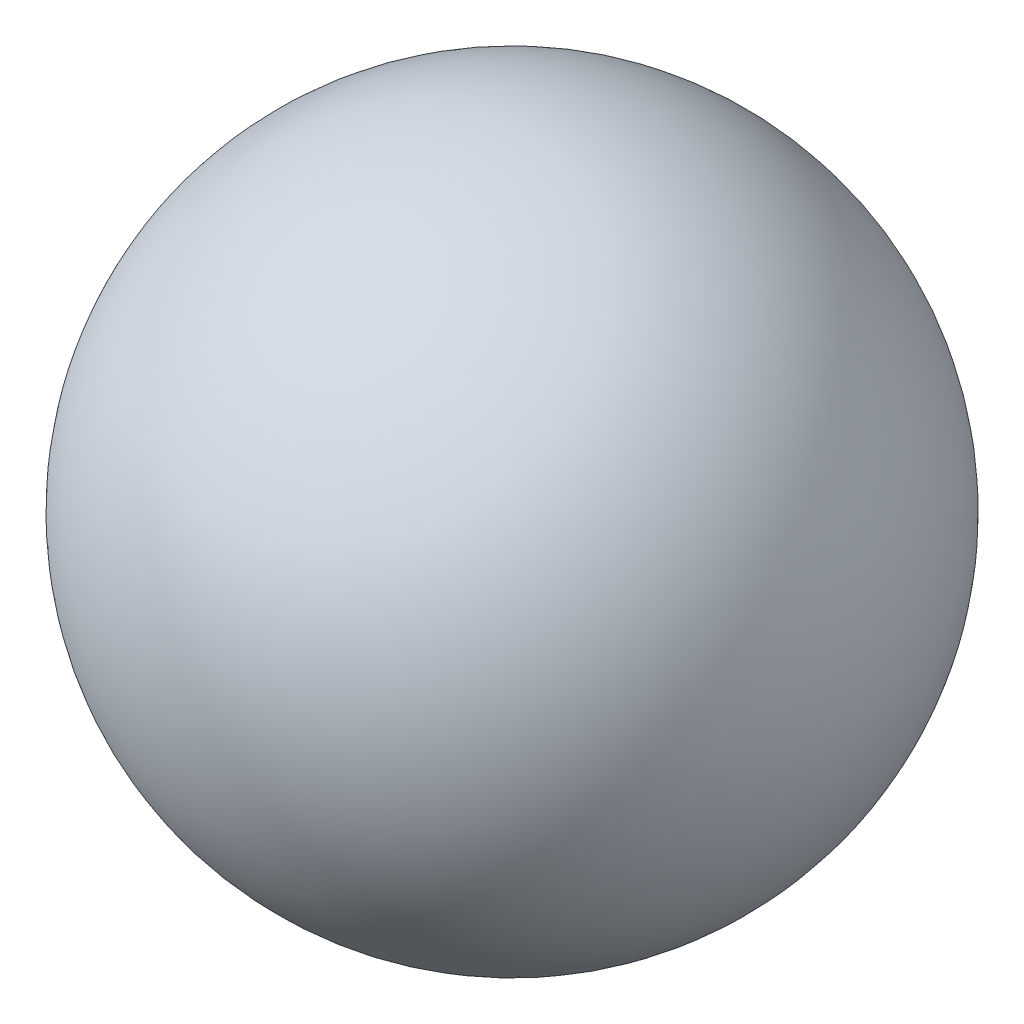
from build123d import *


with BuildPart() as part:
    # Ball Bearing Sketch → Ball Bearing Revolve (revolve)
    with BuildSketch(Plane.XY):
        with BuildLine():
            Line((0.7, 0), (-0.7, 0))
            ThreePointArc((-0.7, 0), (0, 0.7), (0.7, 0))
        make_face()
    revolve(axis=Axis((0.7, 0, 0), (-1, 0, 0)))


solid = part.part
